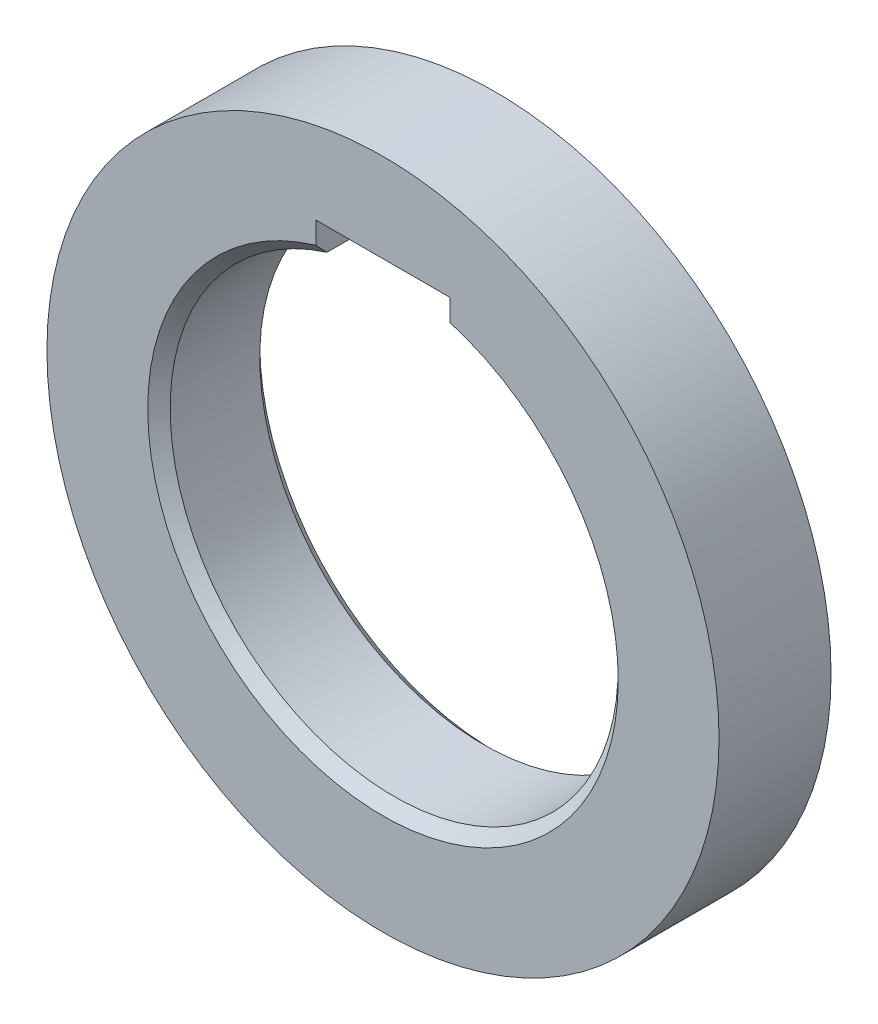
from build123d import *

# Parameters (mm, degrees)
SKETCH1_R           = 30
BOSS_EXTRUDE1_DEPTH = 10
CHAMFER1_SIZE       = 1


with BuildPart() as part:
    # Sketch1 → Boss-Extrude1 (new body)
    with BuildSketch(Plane.XY):
        Circle(SKETCH1_R)
        with BuildLine():
            ThreePointArc((-6, 19.078784028), (0, -20), (6, 19.078784028))
            Line((6, 19.078784028), (6, 22.078784028))
            Line((6, 22.078784028), (-6, 22.078784028))
            Line((-6, 22.078784028), (-6, 19.078784028))
        make_face(mode=Mode.SUBTRACT)
    extrude(amount=-BOSS_EXTRUDE1_DEPTH)

    # Chamfer1
    chamfer1_edges = [part.edges().sort_by_distance(p)[0] for p in [
        (0, -20, -10),
        (0, -20, 0),
    ]]
    chamfer(chamfer1_edges, length=CHAMFER1_SIZE)


solid = part.part
